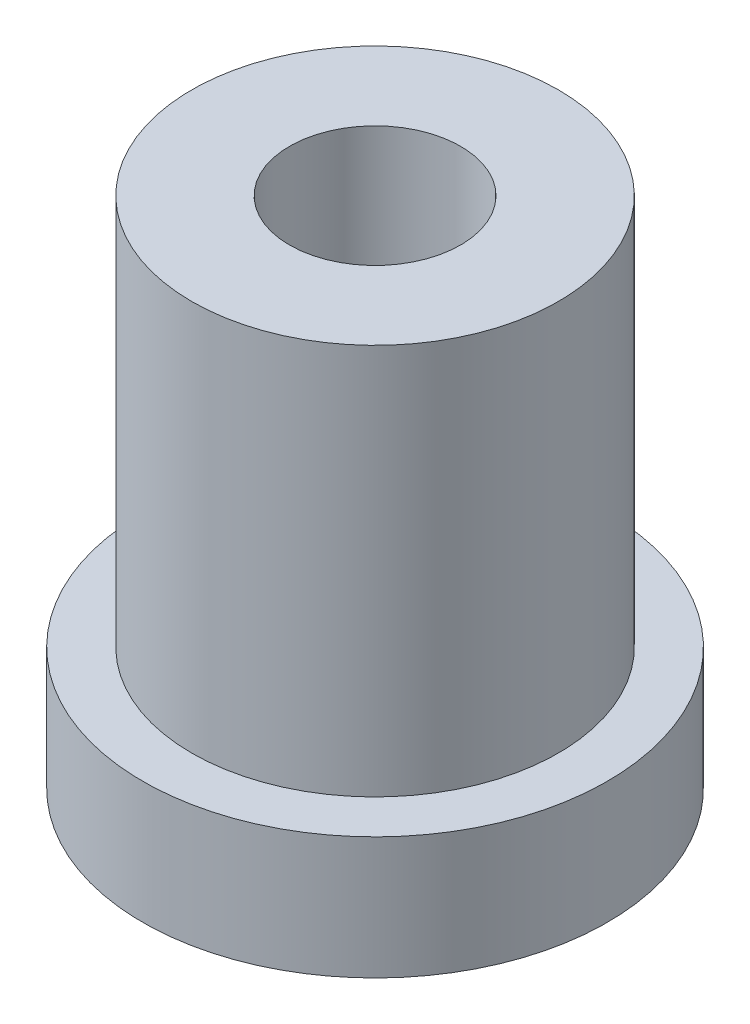
from build123d import *

# Parameters (mm, degrees)
SKETCH1_R                  = 3.75
BOSS_EXTRUDE1_DEPTH        = 10.5
F_3_5_3_5_DIAMETER_HOLE1_D = 3.5
SKETCH5_R                  = 4.75
SKETCH5_R_2                = 3.75
BOSS_EXTRUDE2_DEPTH        = 2.5


with BuildPart() as part:
    # Sketch1 → Boss-Extrude1 (new body)
    with BuildSketch(Plane(origin=(0, 0, 0), x_dir=(1, 0, 0), z_dir=(0, 1, 0))):
        with Locations(Location((0, 0, 0), (0, 0, 90))):
            Circle(SKETCH1_R)
    extrude(amount=BOSS_EXTRUDE1_DEPTH)

    # Ø3.5 (3.5) Diameter Hole1 (through all)
    with Locations(Plane(origin=(0, 10.5, 0), x_dir=(1, 0, 0), z_dir=(0, 1, 0))):
        with Locations((0, 0)):
            Hole(F_3_5_3_5_DIAMETER_HOLE1_D / 2)

    # Sketch5 → Boss-Extrude2 (add)
    with BuildSketch(Plane.XZ):
        with Locations(Location((0, 0, 0), (0, 0, 270))):
            Circle(SKETCH5_R)
        with Locations(Location((0, 0, 0), (0, 0, 270))):
            Circle(SKETCH5_R_2, mode=Mode.SUBTRACT)
    extrude(amount=-BOSS_EXTRUDE2_DEPTH)


solid = part.part
